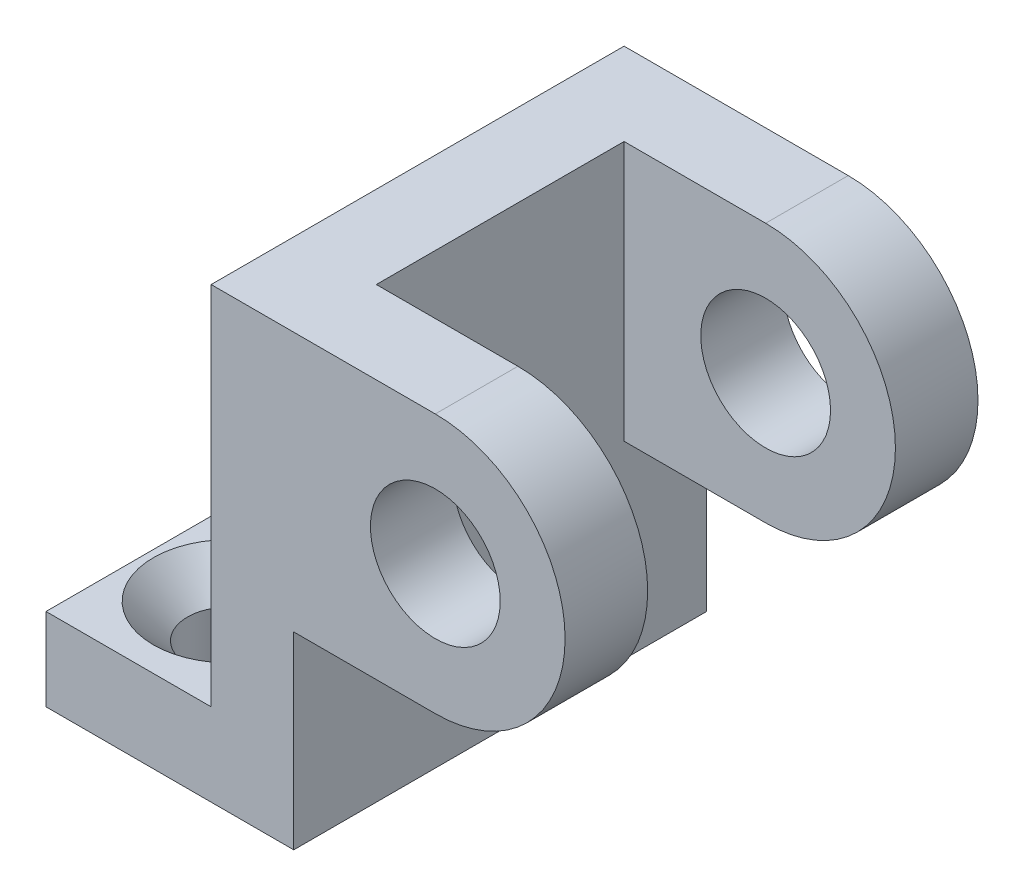
from build123d import *

# Parameters (mm, degrees)
SKETCH_1_W                   = 14
SKETCH_1_H                   = 35
EXTRUDE_1_DEPTH              = 7
HOLE_WIZARD_M6_1_D           = 7
HOLE_WIZARD_M6_1_CSINK_D     = 12.8
HOLE_WIZARD_M6_1_CSINK_ANGLE = 90
SKETCH_6_W                   = 7
SKETCH_6_H                   = 35
EXTRUDE_2_DEPTH              = 38
SKETCH_7_R                   = 5.5
EXTRUDE_3_DEPTH              = 7


with BuildPart() as part:
    # 草图1 → 凸台-拉伸1 (new body)
    with BuildSketch(Plane(origin=(0, 0, 0), x_dir=(1, 0, 0), z_dir=(0, 1, 0))):
        Rectangle(SKETCH_1_W, SKETCH_1_H)
    extrude(amount=EXTRUDE_1_DEPTH)

    # M6 内六角花形半沉头螺钉的锥形沉头孔1 (through all)
    with Locations(Plane(origin=(0, 7, 0), x_dir=(1, 0, 0), z_dir=(0, 1, 0))):
        with Locations((0, -9), (0, 9)):
            CounterSinkHole(HOLE_WIZARD_M6_1_D / 2, HOLE_WIZARD_M6_1_CSINK_D / 2, counter_sink_angle=HOLE_WIZARD_M6_1_CSINK_ANGLE)

    # 草图6 → 凸台-拉伸2 (add)
    with BuildSketch(Plane(origin=(0, 0, 0), x_dir=(1, 0, 0), z_dir=(0, 1, 0))):
        with Locations((10.5, 0)):
            Rectangle(SKETCH_6_W, SKETCH_6_H)
    extrude(amount=EXTRUDE_2_DEPTH)

    # 草图7 → 凸台-拉伸3 (add)
    with BuildSketch(Plane.XY.offset(17.5)):
        with BuildLine():
            Line((14, 38), (26, 38))
            ThreePointArc((26, 38), (37, 27), (26, 16))
            Line((26, 16), (14, 16))
            Line((14, 16), (14, 38))
        make_face()
        with Locations((26, 27)):
            Circle(SKETCH_7_R, mode=Mode.SUBTRACT)
    extrude_3 = extrude(amount=-EXTRUDE_3_DEPTH)

    # 镜向1: 凸台-拉伸3 across plane
    add(extrude_3.mirror(Plane.XY))


solid = part.part
